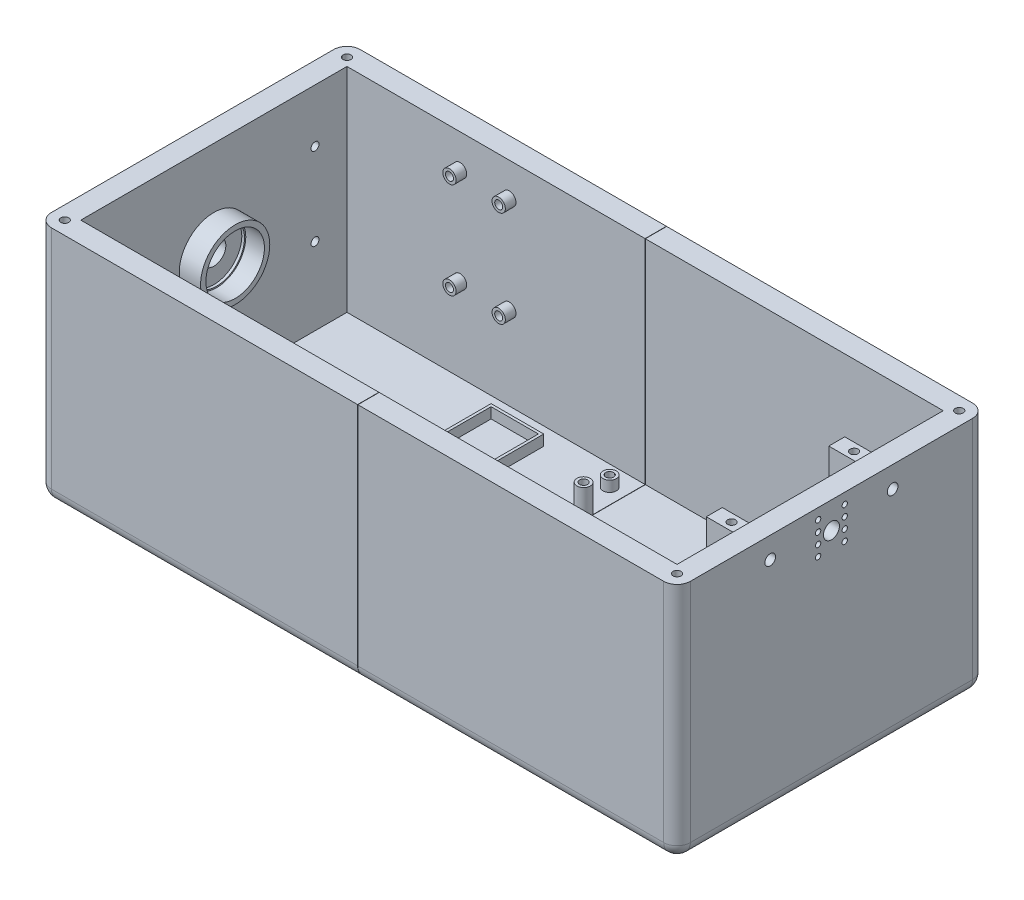
from build123d import *

# Parameters (mm, degrees)
SKETCH1_W                      = 240
SKETCH1_H                      = 116
BOSS_EXTRUDE1_DEPTH            = 10
SKETCH2_W                      = 62.15
SKETCH2_H                      = 62.15
CUT_EXTRUDE1_DEPTH             = 2.5
CUT_EXTRUDE2_REACH             = 135.493
SKETCH3_R                      = 1.5
SKETCH4_W                      = 12
SKETCH4_H                      = 15.5
CUT_EXTRUDE3_DEPTH             = 2.5
CUT_EXTRUDE4_REACH             = 135.493
SKETCH6_R                      = 1.5
CUT_EXTRUDE4_DIRECTION_2_DEPTH = 134.492509153
CUT_EXTRUDE5_REACH             = 135.493
SKETCH7_W                      = 6
SKETCH7_H                      = 15.5
SKETCH8_R                      = 2.5
SKETCH8_R_2                    = 1.5
SKETCH8_R_3                    = 2.347298944
BOSS_EXTRUDE2_DEPTH            = 15
SKETCH9_R                      = 2.5
SKETCH9_R_2                    = 1.5
SKETCH9_W                      = 19.78
SKETCH9_H                      = 34.766
SKETCH9_W_2                    = 17.78
SKETCH9_H_2                    = 32.766
BOSS_EXTRUDE3_DEPTH            = 4
SKETCH10_W                     = 240
SKETCH10_H                     = 116
SKETCH10_W_2                   = 224
SKETCH10_H_2                   = 100
BOSS_EXTRUDE4_DEPTH            = 80
CUT_EXTRUDE14_REACH            = 257.515
SKETCH24_R                     = 1.5
SKETCH14_R                     = 13
SKETCH14_R_2                   = 11
BOSS_EXTRUDE6_DEPTH            = 8
SKETCH16_R                     = 11
SKETCH16_R_2                   = 10.5
BOSS_EXTRUDE7_DEPTH            = 1
CUT_EXTRUDE9_REACH             = 257.515
SKETCH17_R                     = 4.5
SKETCH18_R                     = 2.5
SKETCH18_R_2                   = 1.5
BOSS_EXTRUDE8_DEPTH            = 4
FILLET1_R                      = 5
SKETCH19_R                     = 1.5
CUT_EXTRUDE10_DEPTH            = 20
CUT_EXTRUDE11_REACH            = 264.8
SKETCH20_R                     = 2
SKETCH21_W                     = 6
SKETCH21_H                     = 10
SKETCH21_R                     = 2
BOSS_EXTRUDE9_DEPTH            = 13
CUT_EXTRUDE12_REACH            = 161.163
SKETCH22_R                     = 1.5
CUT_EXTRUDE13_REACH            = 264.8
SKETCH23_R                     = 1
SKETCH23_R_2                   = 3
SKETCH27_W                     = 136.075180926
SKETCH27_H                     = 118.73136012
CUT_EXTRUDE15_DEPTH            = 0.1
SKETCH28_R                     = 2.25
CUT_EXTRUDE16_DEPTH            = 100


with BuildPart() as part:
    # Sketch1 → Boss-Extrude1 (new body)
    with BuildSketch(Plane(origin=(0, 0, 0), x_dir=(1, 0, 0), z_dir=(0, 1, 0))):
        Rectangle(SKETCH1_W, SKETCH1_H)
    extrude(amount=BOSS_EXTRUDE1_DEPTH)

    # Sketch2 → Cut-Extrude1 (cut)
    with BuildSketch(Plane.XZ):
        Rectangle(SKETCH2_W, SKETCH2_H)
    extrude(amount=-CUT_EXTRUDE1_DEPTH, mode=Mode.SUBTRACT)

    # Sketch3 → Cut-Extrude2 (cut, up to next)
    with BuildSketch(Plane.XZ.offset(-2.5), mode=Mode.PRIVATE) as cut_extrude2_sk1:
        with Locations(Location((-26.075, 26.075, 0), (0, 0, 270))):
            Circle(SKETCH3_R)
    cut_extrude2_tool1 = extrude(cut_extrude2_sk1.sketch, amount=-CUT_EXTRUDE2_REACH, mode=Mode.PRIVATE) & part.part
    # Sketch3 → Cut-Extrude2 (cut, up to next)
    with BuildSketch(Plane.XZ.offset(-2.5), mode=Mode.PRIVATE) as cut_extrude2_sk2:
        with Locations(Location((-26.075, -26.075, 0), (0, 0, 90))):
            Circle(SKETCH3_R)
    cut_extrude2_tool2 = extrude(cut_extrude2_sk2.sketch, amount=-CUT_EXTRUDE2_REACH, mode=Mode.PRIVATE) & part.part
    # Sketch3 → Cut-Extrude2 (cut, up to next)
    with BuildSketch(Plane.XZ.offset(-2.5), mode=Mode.PRIVATE) as cut_extrude2_sk3:
        with Locations(Location((26.075, -26.075, 0), (0, 0, 270))):
            Circle(SKETCH3_R)
    cut_extrude2_tool3 = extrude(cut_extrude2_sk3.sketch, amount=-CUT_EXTRUDE2_REACH, mode=Mode.PRIVATE) & part.part
    # Sketch3 → Cut-Extrude2 (cut, up to next)
    with BuildSketch(Plane.XZ.offset(-2.5), mode=Mode.PRIVATE) as cut_extrude2_sk4:
        with Locations(Location((26.075, 26.075, 0), (0, 0, 90))):
            Circle(SKETCH3_R)
    cut_extrude2_tool4 = extrude(cut_extrude2_sk4.sketch, amount=-CUT_EXTRUDE2_REACH, mode=Mode.PRIVATE) & part.part
    add(cut_extrude2_tool1.solids().sort_by_distance((-26.075, 2.5, 26.075))[0], mode=Mode.SUBTRACT)
    add(cut_extrude2_tool2.solids().sort_by_distance((-26.075, 2.5, -26.075))[0], mode=Mode.SUBTRACT)
    add(cut_extrude2_tool3.solids().sort_by_distance((26.075, 2.5, -26.075))[0], mode=Mode.SUBTRACT)
    add(cut_extrude2_tool4.solids().sort_by_distance((26.075, 2.5, 26.075))[0], mode=Mode.SUBTRACT)

    # Sketch4 → Cut-Extrude3 (cut)
    with BuildSketch(Plane.XZ):
        with Locations((54, 0)):
            Rectangle(SKETCH4_W, SKETCH4_H)
    extrude(amount=-CUT_EXTRUDE3_DEPTH, mode=Mode.SUBTRACT)

    # Sketch6 → Cut-Extrude4 (cut, up to next)
    with BuildSketch(Plane.XZ.offset(-2.5), mode=Mode.PRIVATE) as cut_extrude4_sk1:
        with Locations(Location((58, 5.75, 0), (0, 0, 90))):
            Circle(SKETCH6_R)
    cut_extrude4_tool1 = extrude(cut_extrude4_sk1.sketch, amount=-CUT_EXTRUDE4_REACH, mode=Mode.PRIVATE) & part.part
    # Sketch6 → Cut-Extrude4 (cut, up to next)
    with BuildSketch(Plane.XZ.offset(-2.5), mode=Mode.PRIVATE) as cut_extrude4_sk2:
        with Locations(Location((58, -5.75, 0), (0, 0, 90))):
            Circle(SKETCH6_R)
    cut_extrude4_tool2 = extrude(cut_extrude4_sk2.sketch, amount=-CUT_EXTRUDE4_REACH, mode=Mode.PRIVATE) & part.part
    add(cut_extrude4_tool1.solids().sort_by_distance((58, 2.5, 5.75))[0], mode=Mode.SUBTRACT)
    add(cut_extrude4_tool2.solids().sort_by_distance((58, 2.5, -5.75))[0], mode=Mode.SUBTRACT)

    # Sketch6 → Cut-Extrude4 direction 2 (cut)
    with BuildSketch(Plane.XZ.offset(-2.5)):
        with Locations(Location((58, 5.75, 0), (0, 0, 90))):
            Circle(SKETCH6_R)
        with Locations(Location((58, -5.75, 0), (0, 0, 90))):
            Circle(SKETCH6_R)
    extrude(amount=CUT_EXTRUDE4_DIRECTION_2_DEPTH, mode=Mode.SUBTRACT)

    # Sketch7 → Cut-Extrude5 (cut, up to next)
    with BuildSketch(Plane.XZ.offset(-2.5), mode=Mode.PRIVATE) as cut_extrude5_sk1:
        with Locations((51, 0)):
            Rectangle(SKETCH7_W, SKETCH7_H)
    cut_extrude5_tool1 = extrude(cut_extrude5_sk1.sketch, amount=-CUT_EXTRUDE5_REACH, mode=Mode.PRIVATE) & part.part
    add(cut_extrude5_tool1.solids().sort_by_distance((51, 2.5, 0))[0], mode=Mode.SUBTRACT)

    # Sketch8 → Boss-Extrude2 (add)
    # profile 1 of 4: a face of its own
    with BuildSketch(Plane(origin=(0, 10, 0), x_dir=(1, 0, 0), z_dir=(0, 1, 0))):
        with Locations(Location((86.5, 24.2, 0), (0, 0, 270))):
            Circle(SKETCH8_R)
        with Locations(Location((86.5, 24.2, 0), (0, 0, 270))):
            Circle(SKETCH8_R_2, mode=Mode.SUBTRACT)
    # profile 2 of 4: a face of its own
    with BuildSketch(Plane(origin=(0, 10, 0), x_dir=(1, 0, 0), z_dir=(0, 1, 0))):
        with Locations(Location((84.5, -24.2, 0), (0, 0, 270))):
            Circle(SKETCH8_R_3)
        with Locations(Location((84.5, -24.2, 0), (0, 0, 270))):
            Circle(SKETCH8_R_2, mode=Mode.SUBTRACT)
    # profile 3 of 4: a face of its own
    with BuildSketch(Plane(origin=(0, 10, 0), x_dir=(1, 0, 0), z_dir=(0, 1, 0))):
        with Locations(Location((9.7, -24.2, 0), (0, 0, 270))):
            Circle(SKETCH8_R)
        with Locations(Location((9.7, -24.2, 0), (0, 0, 270))):
            Circle(SKETCH8_R_2, mode=Mode.SUBTRACT)
    # profile 4 of 4: a face of its own
    with BuildSketch(Plane(origin=(0, 10, 0), x_dir=(1, 0, 0), z_dir=(0, 1, 0))):
        with Locations(Location((2.7, 24.2, 0), (0, 0, 270))):
            Circle(SKETCH8_R)
        with Locations(Location((2.7, 24.2, 0), (0, 0, 270))):
            Circle(SKETCH8_R_2, mode=Mode.SUBTRACT)
    extrude(amount=BOSS_EXTRUDE2_DEPTH)

    # Sketch9 → Boss-Extrude3 (add)
    # profile 1 of 5: a face of its own
    with BuildSketch(Plane(origin=(0, 10, 0), x_dir=(1, 0, 0), z_dir=(0, 1, 0))):
        with Locations(Location((-24.1, 15.8, 0), (0, 0, 270))):
            Circle(SKETCH9_R)
        with Locations(Location((-24.1, 15.8, 0), (0, 0, 270))):
            Circle(SKETCH9_R_2, mode=Mode.SUBTRACT)
    # profile 2 of 5: a face of its own
    with BuildSketch(Plane(origin=(0, 10, 0), x_dir=(1, 0, 0), z_dir=(0, 1, 0))):
        with Locations(Location((-5.8, 15.8, 0), (0, 0, 270))):
            Circle(SKETCH9_R)
        with Locations(Location((-5.8, 15.8, 0), (0, 0, 270))):
            Circle(SKETCH9_R_2, mode=Mode.SUBTRACT)
    # profile 3 of 5: a face of its own
    with BuildSketch(Plane(origin=(0, 10, 0), x_dir=(1, 0, 0), z_dir=(0, 1, 0))):
        with Locations(Location((-5.8, 42.5, 0), (0, 0, 270))):
            Circle(SKETCH9_R)
        with Locations(Location((-5.8, 42.5, 0), (0, 0, 270))):
            Circle(SKETCH9_R_2, mode=Mode.SUBTRACT)
    # profile 4 of 5: a face of its own
    with BuildSketch(Plane(origin=(0, 10, 0), x_dir=(1, 0, 0), z_dir=(0, 1, 0))):
        Polygon((-17.7, -47), (-17.7, -48), (-22.7, -48), (-22.7, -22.8), (-3.3, -22.8), (-3.3, -48), (-8.3, -48), (-8.3, -47), (-4.3, -47), (-4.3, -23.8), (-21.7, -23.8), (-21.7, -47), align=None)
    # profile 5 of 5: a face of its own
    with BuildSketch(Plane(origin=(0, 10, 0), x_dir=(1, 0, 0), z_dir=(0, 1, 0))):
        with Locations((-41.35, 26)):
            Rectangle(SKETCH9_W, SKETCH9_H)
        with Locations((-41.35, 26)):
            Rectangle(SKETCH9_W_2, SKETCH9_H_2, mode=Mode.SUBTRACT)
    extrude(amount=BOSS_EXTRUDE3_DEPTH)

    # Sketch10 → Boss-Extrude4 (add)
    with BuildSketch(Plane(origin=(0, 10, 0), x_dir=(1, 0, 0), z_dir=(0, 1, 0))):
        Rectangle(SKETCH10_W, SKETCH10_H)
        Rectangle(SKETCH10_W_2, SKETCH10_H_2, mode=Mode.SUBTRACT)
    extrude(amount=BOSS_EXTRUDE4_DEPTH)

    # Sketch24 → Cut-Extrude14 (cut, up to next)
    with BuildSketch(Plane(origin=(-112, 0, 0), x_dir=(0, 0, -1), z_dir=(1, 0, 0)), mode=Mode.PRIVATE) as cut_extrude14_sk1:
        with Locations((-38, 70)):
            Circle(SKETCH24_R)
    cut_extrude14_tool1 = extrude(cut_extrude14_sk1.sketch, amount=-CUT_EXTRUDE14_REACH, mode=Mode.PRIVATE) & part.part
    # Sketch24 → Cut-Extrude14 (cut, up to next)
    with BuildSketch(Plane(origin=(-112, 0, 0), x_dir=(0, 0, -1), z_dir=(1, 0, 0)), mode=Mode.PRIVATE) as cut_extrude14_sk2:
        with Locations((-38, 39)):
            Circle(SKETCH24_R)
    cut_extrude14_tool2 = extrude(cut_extrude14_sk2.sketch, amount=-CUT_EXTRUDE14_REACH, mode=Mode.PRIVATE) & part.part
    # Sketch24 → Cut-Extrude14 (cut, up to next)
    with BuildSketch(Plane(origin=(-112, 0, 0), x_dir=(0, 0, -1), z_dir=(1, 0, 0)), mode=Mode.PRIVATE) as cut_extrude14_sk3:
        with Locations((38, 39)):
            Circle(SKETCH24_R)
    cut_extrude14_tool3 = extrude(cut_extrude14_sk3.sketch, amount=-CUT_EXTRUDE14_REACH, mode=Mode.PRIVATE) & part.part
    # Sketch24 → Cut-Extrude14 (cut, up to next)
    with BuildSketch(Plane(origin=(-112, 0, 0), x_dir=(0, 0, -1), z_dir=(1, 0, 0)), mode=Mode.PRIVATE) as cut_extrude14_sk4:
        with Locations((38, 70)):
            Circle(SKETCH24_R)
    cut_extrude14_tool4 = extrude(cut_extrude14_sk4.sketch, amount=-CUT_EXTRUDE14_REACH, mode=Mode.PRIVATE) & part.part
    add(cut_extrude14_tool1.solids().sort_by_distance((-112, 70, 38))[0], mode=Mode.SUBTRACT)
    add(cut_extrude14_tool2.solids().sort_by_distance((-112, 39, 38))[0], mode=Mode.SUBTRACT)
    add(cut_extrude14_tool3.solids().sort_by_distance((-112, 39, -38))[0], mode=Mode.SUBTRACT)
    add(cut_extrude14_tool4.solids().sort_by_distance((-112, 70, -38))[0], mode=Mode.SUBTRACT)

    # Sketch14 → Boss-Extrude6 (add)
    with BuildSketch(Plane(origin=(-112, 0, 0), x_dir=(0, 0, -1), z_dir=(1, 0, 0))):
        with Locations((0, 54.5)):
            Circle(SKETCH14_R)
        with Locations((0, 54.5)):
            Circle(SKETCH14_R_2, mode=Mode.SUBTRACT)
    extrude(amount=BOSS_EXTRUDE6_DEPTH)

    # Sketch16 → Boss-Extrude7 (add)
    with BuildSketch(Plane(origin=(-112, 0, 0), x_dir=(0, 0, -1), z_dir=(1, 0, 0))):
        with Locations((0, 54.5)):
            Circle(SKETCH16_R)
        with Locations((0, 54.5)):
            Circle(SKETCH16_R_2, mode=Mode.SUBTRACT)
    extrude(amount=BOSS_EXTRUDE7_DEPTH)

    # Sketch17 → Cut-Extrude9 (cut, up to next)
    with BuildSketch(Plane(origin=(-112, 0, 0), x_dir=(0, 0, -1), z_dir=(1, 0, 0)), mode=Mode.PRIVATE) as cut_extrude9_sk1:
        with Locations((0, 54.5)):
            Circle(SKETCH17_R)
    cut_extrude9_tool1 = extrude(cut_extrude9_sk1.sketch, amount=-CUT_EXTRUDE9_REACH, mode=Mode.PRIVATE) & part.part
    add(cut_extrude9_tool1.solids().sort_by_distance((-112, 54.5, 0))[0], mode=Mode.SUBTRACT)

    # Sketch18 → Boss-Extrude8 (add)
    # profile 1 of 4: a face of its own
    with BuildSketch(Plane.XY.offset(-50)):
        with Locations((-69.5, 77.5)):
            Circle(SKETCH18_R)
        with Locations((-69.5, 77.5)):
            Circle(SKETCH18_R_2, mode=Mode.SUBTRACT)
    # profile 2 of 4: a face of its own
    with BuildSketch(Plane.XY.offset(-50)):
        with Locations(Location((-69.5, 41.351210886, 0), (0, 0, 180))):
            Circle(SKETCH18_R)
        with Locations(Location((-69.5, 41.351210886, 0), (0, 0, 180))):
            Circle(SKETCH18_R_2, mode=Mode.SUBTRACT)
    # profile 3 of 4: a face of its own
    with BuildSketch(Plane.XY.offset(-50)):
        with Locations((-51, 41.351210886)):
            Circle(SKETCH18_R)
        with Locations((-51, 41.351210886)):
            Circle(SKETCH18_R_2, mode=Mode.SUBTRACT)
    # profile 4 of 4: a face of its own
    with BuildSketch(Plane.XY.offset(-50)):
        with Locations(Location((-51, 77.5, 0), (0, 0, 180))):
            Circle(SKETCH18_R)
        with Locations(Location((-51, 77.5, 0), (0, 0, 180))):
            Circle(SKETCH18_R_2, mode=Mode.SUBTRACT)
    extrude(amount=BOSS_EXTRUDE8_DEPTH)

    # Fillet1
    fillet1_edges = [part.edges().sort_by_distance(p)[0] for p in [
        (0, 0, 58),
        (-120, 0, 0),
        (0, 0, -58),
        (120, 0, 0),
        (120, 45, 58),
        (-120, 45, 58),
        (-120, 45, -58),
        (120, 45, -58),
    ]]
    fillet(fillet1_edges, radius=FILLET1_R)

    # Sketch19 → Cut-Extrude10 (cut)
    with BuildSketch(Plane(origin=(0, 90, 0), x_dir=(1, 0, 0), z_dir=(0, 1, 0))):
        with Locations(Location((115, 53, 0), (0, 0, 270))):
            Circle(SKETCH19_R)
        with Locations(Location((-115, 53, 0), (0, 0, 270))):
            Circle(SKETCH19_R)
        with Locations(Location((-115, -53, 0), (0, 0, 270))):
            Circle(SKETCH19_R)
        with Locations(Location((115, -53, 0), (0, 0, 270))):
            Circle(SKETCH19_R)
    extrude(amount=-CUT_EXTRUDE10_DEPTH, mode=Mode.SUBTRACT)

    # Sketch20 → Cut-Extrude11 (cut, up to next)
    with BuildSketch(Plane(origin=(120, 0, 0), x_dir=(0, 0, -1), z_dir=(1, 0, 0)), mode=Mode.PRIVATE) as cut_extrude11_sk1:
        with Locations((-23, 82)):
            Circle(SKETCH20_R)
    cut_extrude11_tool1 = extrude(cut_extrude11_sk1.sketch, amount=-CUT_EXTRUDE11_REACH, mode=Mode.PRIVATE) & part.part
    # Sketch20 → Cut-Extrude11 (cut, up to next)
    with BuildSketch(Plane(origin=(120, 0, 0), x_dir=(0, 0, -1), z_dir=(1, 0, 0)), mode=Mode.PRIVATE) as cut_extrude11_sk2:
        with Locations(Location((23, 82, 0), (0, 0, 180))):
            Circle(SKETCH20_R)
    cut_extrude11_tool2 = extrude(cut_extrude11_sk2.sketch, amount=-CUT_EXTRUDE11_REACH, mode=Mode.PRIVATE) & part.part
    add(cut_extrude11_tool1.solids().sort_by_distance((120, 82, 23))[0], mode=Mode.SUBTRACT)
    add(cut_extrude11_tool2.solids().sort_by_distance((120, 82, -23))[0], mode=Mode.SUBTRACT)

    # Sketch21 → Boss-Extrude9 (add)
    # profile 1 of 2: a face of its own
    with BuildSketch(Plane.ZY.offset(-112)):
        with Locations((-23, 82)):
            Rectangle(SKETCH21_W, SKETCH21_H)
        with Locations((-23, 82)):
            Circle(SKETCH21_R, mode=Mode.SUBTRACT)
    # profile 2 of 2: a face of its own
    with BuildSketch(Plane.ZY.offset(-112)):
        with Locations((23, 82)):
            Rectangle(SKETCH21_W, SKETCH21_H)
        with Locations(Location((23, 82, 0), (0, 0, 180))):
            Circle(SKETCH21_R, mode=Mode.SUBTRACT)
    extrude(amount=BOSS_EXTRUDE9_DEPTH)

    # Sketch22 → Cut-Extrude12 (cut, up to next)
    with BuildSketch(Plane(origin=(0, 87, 0), x_dir=(1, 0, 0), z_dir=(0, 1, 0)), mode=Mode.PRIVATE) as cut_extrude12_sk1:
        with Locations(Location((105.5, -23, 0), (0, 0, 270))):
            Circle(SKETCH22_R)
    cut_extrude12_tool1 = extrude(cut_extrude12_sk1.sketch, amount=-CUT_EXTRUDE12_REACH, mode=Mode.PRIVATE) & part.part
    # Sketch22 → Cut-Extrude12 (cut, up to next)
    with BuildSketch(Plane(origin=(0, 87, 0), x_dir=(1, 0, 0), z_dir=(0, 1, 0)), mode=Mode.PRIVATE) as cut_extrude12_sk2:
        with Locations(Location((105.5, 23, 0), (0, 0, 270))):
            Circle(SKETCH22_R)
    cut_extrude12_tool2 = extrude(cut_extrude12_sk2.sketch, amount=-CUT_EXTRUDE12_REACH, mode=Mode.PRIVATE) & part.part
    add(cut_extrude12_tool1.solids().sort_by_distance((105.5, 87, 23))[0], mode=Mode.SUBTRACT)
    add(cut_extrude12_tool2.solids().sort_by_distance((105.5, 87, -23))[0], mode=Mode.SUBTRACT)

    # Sketch23 → Cut-Extrude13 (cut, up to next)
    with BuildSketch(Plane(origin=(120, 0, 0), x_dir=(0, 0, -1), z_dir=(1, 0, 0)), mode=Mode.PRIVATE) as cut_extrude13_sk1:
        with Locations((5, 78)):
            Circle(SKETCH23_R)
    cut_extrude13_tool1 = extrude(cut_extrude13_sk1.sketch, amount=-CUT_EXTRUDE13_REACH, mode=Mode.PRIVATE) & part.part
    # Sketch23 → Cut-Extrude13 (cut, up to next)
    with BuildSketch(Plane(origin=(120, 0, 0), x_dir=(0, 0, -1), z_dir=(1, 0, 0)), mode=Mode.PRIVATE) as cut_extrude13_sk2:
        with Locations((-5, 78)):
            Circle(SKETCH23_R)
    cut_extrude13_tool2 = extrude(cut_extrude13_sk2.sketch, amount=-CUT_EXTRUDE13_REACH, mode=Mode.PRIVATE) & part.part
    # Sketch23 → Cut-Extrude13 (cut, up to next)
    with BuildSketch(Plane(origin=(120, 0, 0), x_dir=(0, 0, -1), z_dir=(1, 0, 0)), mode=Mode.PRIVATE) as cut_extrude13_sk3:
        with Locations((5, 74)):
            Circle(SKETCH23_R)
    cut_extrude13_tool3 = extrude(cut_extrude13_sk3.sketch, amount=-CUT_EXTRUDE13_REACH, mode=Mode.PRIVATE) & part.part
    # Sketch23 → Cut-Extrude13 (cut, up to next)
    with BuildSketch(Plane(origin=(120, 0, 0), x_dir=(0, 0, -1), z_dir=(1, 0, 0)), mode=Mode.PRIVATE) as cut_extrude13_sk4:
        with Locations((-5, 74)):
            Circle(SKETCH23_R)
    cut_extrude13_tool4 = extrude(cut_extrude13_sk4.sketch, amount=-CUT_EXTRUDE13_REACH, mode=Mode.PRIVATE) & part.part
    # Sketch23 → Cut-Extrude13 (cut, up to next)
    with BuildSketch(Plane(origin=(120, 0, 0), x_dir=(0, 0, -1), z_dir=(1, 0, 0)), mode=Mode.PRIVATE) as cut_extrude13_sk5:
        with Locations(Location((-5, 86, 0), (0, 0, 180))):
            Circle(SKETCH23_R)
    cut_extrude13_tool5 = extrude(cut_extrude13_sk5.sketch, amount=-CUT_EXTRUDE13_REACH, mode=Mode.PRIVATE) & part.part
    # Sketch23 → Cut-Extrude13 (cut, up to next)
    with BuildSketch(Plane(origin=(120, 0, 0), x_dir=(0, 0, -1), z_dir=(1, 0, 0)), mode=Mode.PRIVATE) as cut_extrude13_sk6:
        with Locations(Location((5, 86, 0), (0, 0, 180))):
            Circle(SKETCH23_R)
    cut_extrude13_tool6 = extrude(cut_extrude13_sk6.sketch, amount=-CUT_EXTRUDE13_REACH, mode=Mode.PRIVATE) & part.part
    # Sketch23 → Cut-Extrude13 (cut, up to next)
    with BuildSketch(Plane(origin=(120, 0, 0), x_dir=(0, 0, -1), z_dir=(1, 0, 0)), mode=Mode.PRIVATE) as cut_extrude13_sk7:
        with Locations(Location((-5, 82, 0), (0, 0, 180))):
            Circle(SKETCH23_R)
    cut_extrude13_tool7 = extrude(cut_extrude13_sk7.sketch, amount=-CUT_EXTRUDE13_REACH, mode=Mode.PRIVATE) & part.part
    # Sketch23 → Cut-Extrude13 (cut, up to next)
    with BuildSketch(Plane(origin=(120, 0, 0), x_dir=(0, 0, -1), z_dir=(1, 0, 0)), mode=Mode.PRIVATE) as cut_extrude13_sk8:
        with Locations(Location((5, 82, 0), (0, 0, 180))):
            Circle(SKETCH23_R)
    cut_extrude13_tool8 = extrude(cut_extrude13_sk8.sketch, amount=-CUT_EXTRUDE13_REACH, mode=Mode.PRIVATE) & part.part
    # Sketch23 → Cut-Extrude13 (cut, up to next)
    with BuildSketch(Plane(origin=(120, 0, 0), x_dir=(0, 0, -1), z_dir=(1, 0, 0)), mode=Mode.PRIVATE) as cut_extrude13_sk9:
        with Locations((0, 80)):
            Circle(SKETCH23_R_2)
    cut_extrude13_tool9 = extrude(cut_extrude13_sk9.sketch, amount=-CUT_EXTRUDE13_REACH, mode=Mode.PRIVATE) & part.part
    add(cut_extrude13_tool1.solids().sort_by_distance((120, 78, -5))[0], mode=Mode.SUBTRACT)
    add(cut_extrude13_tool2.solids().sort_by_distance((120, 78, 5))[0], mode=Mode.SUBTRACT)
    add(cut_extrude13_tool3.solids().sort_by_distance((120, 74, -5))[0], mode=Mode.SUBTRACT)
    add(cut_extrude13_tool4.solids().sort_by_distance((120, 74, 5))[0], mode=Mode.SUBTRACT)
    add(cut_extrude13_tool5.solids().sort_by_distance((120, 86, 5))[0], mode=Mode.SUBTRACT)
    add(cut_extrude13_tool6.solids().sort_by_distance((120, 86, -5))[0], mode=Mode.SUBTRACT)
    add(cut_extrude13_tool7.solids().sort_by_distance((120, 82, 5))[0], mode=Mode.SUBTRACT)
    add(cut_extrude13_tool8.solids().sort_by_distance((120, 82, -5))[0], mode=Mode.SUBTRACT)
    add(cut_extrude13_tool9.solids().sort_by_distance((120, 80, 0))[0], mode=Mode.SUBTRACT)

    # Sketch27 → Cut-Extrude15 (cut)
    with BuildSketch(Plane.ZY):
        with Locations((0, 54.5)):
            Rectangle(SKETCH27_W, SKETCH27_H)
    extrude(amount=-CUT_EXTRUDE15_DEPTH, mode=Mode.SUBTRACT)


with BuildPart() as cut_extrude15_piece_1:
    # of the separate pieces the step leaves, piece 1, a body of its own (cut_extrude15_pieces)
    add(part.part.solids().sort_by_distance((-115, 5, -58))[0])

    # Sketch28 → Cut-Extrude16 (cut)
    with BuildSketch(Plane(origin=(0, 0, 0), x_dir=(0, 0, -1), z_dir=(1, 0, 0))):
        with Locations((-48, 4)):
            Circle(SKETCH28_R)
        with Locations((48, 4)):
            Circle(SKETCH28_R)
    extrude(amount=-CUT_EXTRUDE16_DEPTH, mode=Mode.SUBTRACT)


with BuildPart() as cut_extrude15_piece_2:
    # of the separate pieces the step leaves, piece 2, a body of its own (cut_extrude15_pieces)
    add(part.part.solids().sort_by_distance((0.1, 90, -58))[0])


solid = Compound([cut_extrude15_piece_1.part, cut_extrude15_piece_2.part])
